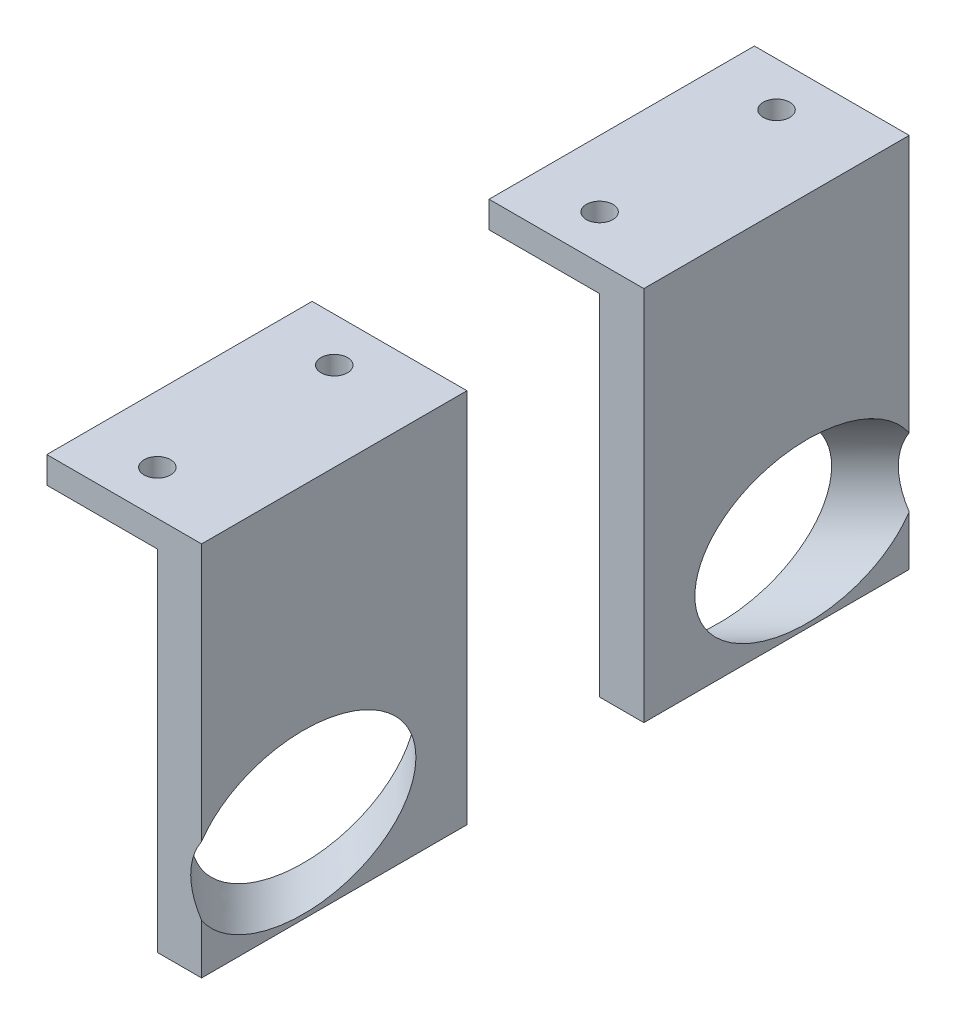
from build123d import *

# Parameters (mm, degrees)
SKETCH_1_W          = 30
SKETCH_1_H          = 39.5
EXTRUDE_1_DEPTH     = 5
SKETCH_3_W          = 17.5
SKETCH_3_H          = 30
EXTRUDE_2_DEPTH     = 3
SKETCH_6_R          = 1.5
CUT_EXTRUDE_2_DEPTH = 3
SKETCH_7_RX         = 12.728
SKETCH_7_RY         = 9
CUT_EXTRUDE_3_DEPTH = 10


with BuildPart() as part:
    # 草图1 → 凸台-拉伸1 (new body)
    with BuildSketch(Plane(origin=(0, 0, 0), x_dir=(0, 0, -1), z_dir=(1, 0, 0))):
        with Locations((0, -8.75)):
            Rectangle(SKETCH_1_W, SKETCH_1_H)
    extrude(amount=EXTRUDE_1_DEPTH)

    # 草图3 → 凸台-拉伸2 (add)
    with BuildSketch(Plane(origin=(0, 11, 0), x_dir=(1, 0, 0), z_dir=(0, 1, 0))):
        with Locations((-3.75, 0)):
            Rectangle(SKETCH_3_W, SKETCH_3_H)
    extrude(amount=EXTRUDE_2_DEPTH)

    # 草图6 → 切除-拉伸2 (cut)
    with BuildSketch(Plane(origin=(0, 14, 0), x_dir=(1, 0, 0), z_dir=(0, 1, 0))):
        with Locations(Location((-5, 10, 0), (0, 0, 270))):
            Circle(SKETCH_6_R)
        with Locations(Location((-5, -10, 0), (0, 0, 270))):
            Circle(SKETCH_6_R)
    extrude(amount=-CUT_EXTRUDE_2_DEPTH, mode=Mode.SUBTRACT)

    # 草图7 → 切除-拉伸3 (cut, along a direction that is not the sketch's normal)
    with BuildSketch(Plane(origin=(0, 0, 0), x_dir=(0, 0, -1), z_dir=(1, 0, 0))):
        with Locations(Location((1.5, -19), (0, 0, 180))):
            Ellipse(SKETCH_7_RX, SKETCH_7_RY)
    extrude(amount=CUT_EXTRUDE_3_DEPTH, dir=(0.7071067811865512, 0, 0.7071067811865439), mode=Mode.SUBTRACT)


with BuildPart() as body_2:
    # 镜向1: mirrored copy
    add(part.part.mirror(Plane(origin=(0, 0, -25), x_dir=(1, 0, 0), z_dir=(0, 0, -1))))


solid = Compound([part.part, body_2.part])
